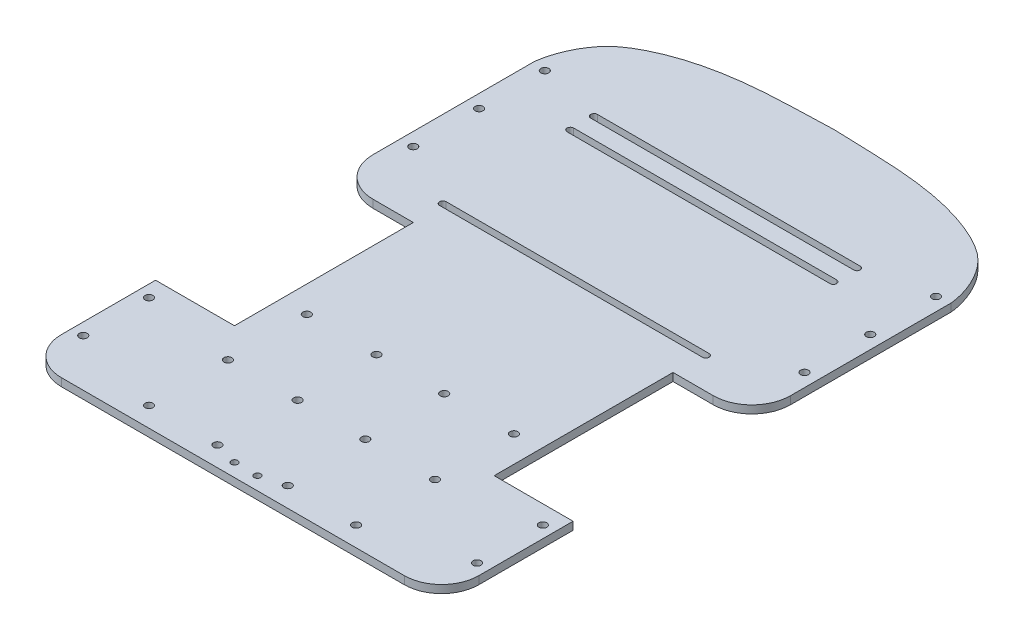
from build123d import *

# Parameters (mm, degrees)
SKETCH4_R           = 1.5
SKETCH4_R_2         = 1.25
BOSS_EXTRUDE2_DEPTH = 3


with BuildPart() as part:
    # Sketch4 → Boss-Extrude2 (new body)
    with BuildSketch(Plane(origin=(0, 0, 0), x_dir=(1, 0, 0), z_dir=(0, 1, 0))):
        with BuildLine():
            Line((0, 128.6), (0, 0))
            Line((0, 0), (-65.208953904, 0))
            ThreePointArc((-65.208953904, 0), (-75.225861161, 4.149138839), (-79.375, 14.166046096))
            Line((-79.375, 14.166046096), (-79.375, 50))
            Line((-79.375, 50), (-49.375, 50))
            Line((-49.375, 50), (-49.375, 118))
            Line((-49.375, 118), (-64.675, 118))
            ThreePointArc((-64.675, 118), (-75.069469683, 122.305530317), (-79.375, 132.7))
            Line((-79.375, 132.7), (-79.375, 193.786049975))
            add(Edge.make_bspline(
                [(-79.375, 193.786049975), (-78.783979858, 199.964089634), (-73.952599984, 211.643726286), (-54.660456042, 223.601842558), (-29.545703417, 228.182905558), (-9.188135392, 228.171492971), (0, 228.6)],
                knots=[0, 0, 0, 0, 0.226113446, 0.328670148, 0.719907193, 1, 1, 1, 1], degree=3))
            Line((0, 228.6), (0, 188.6))
            Line((0, 188.6), (-50, 188.6))
            ThreePointArc((-50, 188.6), (-51.25, 187.35), (-50, 186.1))
            Line((-50, 186.1), (0, 186.1))
            Line((0, 186.1), (0, 179.6))
            Line((0, 179.6), (-50, 179.6))
            ThreePointArc((-50, 179.6), (-51.25, 178.35), (-50, 177.1))
            Line((-50, 177.1), (0, 177.1))
            Line((0, 177.1), (0, 131.1))
            Line((0, 131.1), (-50, 131.1))
            ThreePointArc((-50, 131.1), (-51.25, 129.85), (-50, 128.6))
            Line((-50, 128.6), (0, 128.6))
        make_face()
        with Locations(Location((-74.875, 43, 0), (0, 0, 270))):
            Circle(SKETCH4_R, mode=Mode.SUBTRACT)
        with Locations(Location((-74.875, 18, 0), (0, 0, 270))):
            Circle(SKETCH4_R, mode=Mode.SUBTRACT)
        with Locations(Location((-39.375, 7.5, 0), (0, 0, 270))):
            Circle(SKETCH4_R, mode=Mode.SUBTRACT)
        with Locations(Location((-13.375, 7.5, 0), (0, 0, 270))):
            Circle(SKETCH4_R, mode=Mode.SUBTRACT)
        with Locations(Location((-4.375, 5, 0), (0, 0, 270))):
            Circle(SKETCH4_R_2, mode=Mode.SUBTRACT)
        with Locations(Location((-74.375, 143, 0), (0, 0, 270))):
            Circle(SKETCH4_R, mode=Mode.SUBTRACT)
        with Locations(Location((-74.375, 168, 0), (0, 0, 270))):
            Circle(SKETCH4_R, mode=Mode.SUBTRACT)
        with Locations(Location((-74.375, 193, 0), (0, 0, 270))):
            Circle(SKETCH4_R, mode=Mode.SUBTRACT)
        with Locations(Location((-39.375, 37.5, 0), (0, 0, 270))):
            Circle(SKETCH4_R, mode=Mode.SUBTRACT)
        with Locations(Location((-39.375, 67.5, 0), (0, 0, 270))):
            Circle(SKETCH4_R, mode=Mode.SUBTRACT)
        with Locations(Location((-12.875, 37.5, 0), (0, 0, 270))):
            Circle(SKETCH4_R, mode=Mode.SUBTRACT)
        with Locations(Location((-12.875, 67.5, 0), (0, 0, 270))):
            Circle(SKETCH4_R, mode=Mode.SUBTRACT)
    boss_extrude2 = extrude(amount=BOSS_EXTRUDE2_DEPTH)

    # Mirror4: part across plane


with BuildPart() as part_1:
    add(part.part)
    add(part.part.mirror(Plane(origin=(0, 3, -177.1), x_dir=(0, 0, 1), z_dir=(-1, 0, 0))))


with BuildPart() as mirror2_1:
    # Mirror2: Boss-Extrude2 across Right Plane
    add(boss_extrude2.mirror(Plane(origin=(0, 0, 0), x_dir=(0, 0, -1), z_dir=(1, 0, 0))))


with BuildPart() as part_2:
    add(part_1.part)

    # Mirror2 united with what the copies touc: union Mirror2_1
    add(mirror2_1.part)


solid = part_2.part
